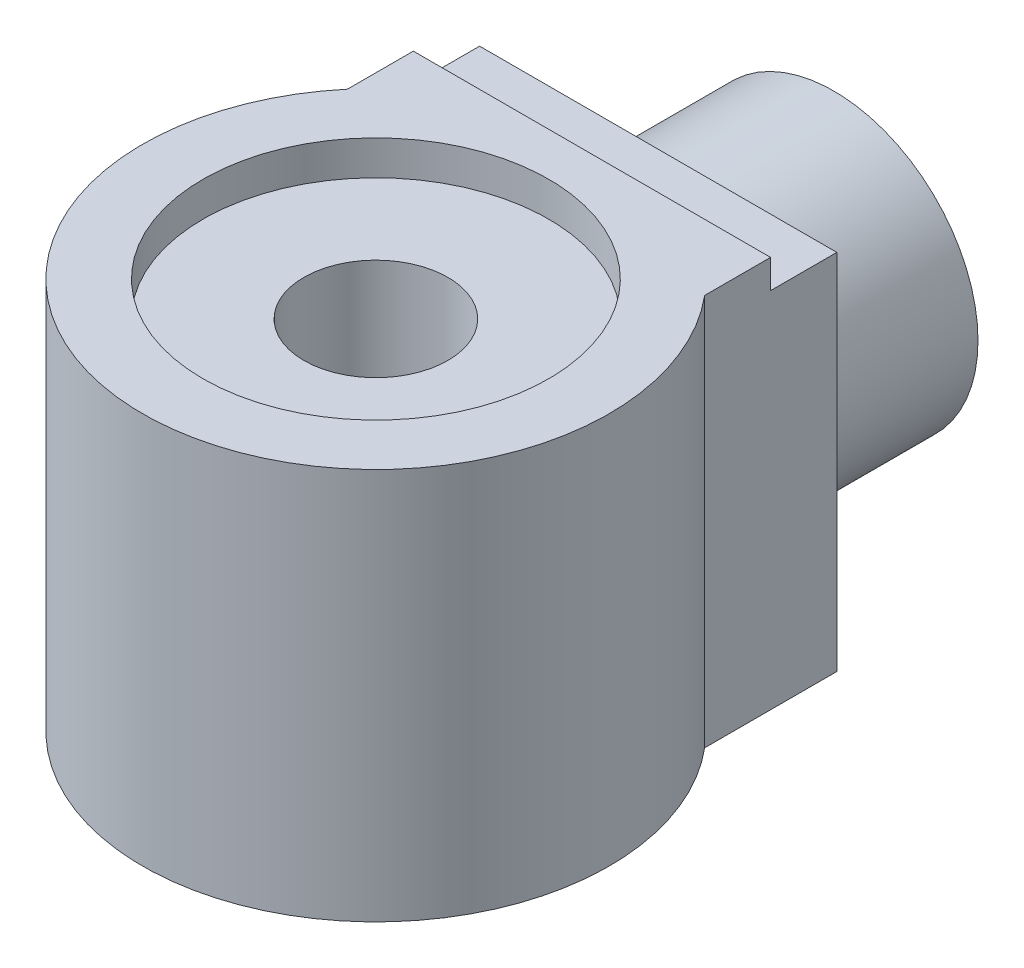
from build123d import *

# Parameters (mm, degrees)
BOSS_EXTRUDE1_DEPTH        = 34.544
SKETCH2_R                  = 15.24
CUT_EXTRUDE1_DEPTH         = 3.048
F_1_2_0_5_DIAMETER_HOLE1_D = 12.7
SKETCH5_W                  = 31.496
SKETCH5_H                  = 5.842
CUT_EXTRUDE2_DEPTH         = 2.54
SKETCH8_R                  = 12.7
SKETCH8_R_2                = 10.668
BOSS_EXTRUDE3_DEPTH        = 15.494
SKETCH9_R                  = 6.477
BOSS_EXTRUDE4_DEPTH        = 19.05
SKETCH6_R                  = 12.7
BOSS_EXTRUDE2_DEPTH        = 15.494
CUT_EXTRUDE3_START         = -15.494
SKETCH7_R                  = 10.668
SKETCH7_R_2                = 6.477
CUT_EXTRUDE3_DEPTH         = 15.494


with BuildPart() as part:
    # Sketch1 → Boss-Extrude1 (new body)
    with BuildSketch(Plane(origin=(0, 0, 0), x_dir=(1, 0, 0), z_dir=(0, 1, 0))):
        with BuildLine():
            Line((15.748, 24.892), (-15.748, 24.892))
            Line((-15.748, 24.892), (-15.748, 13.23971193))
            ThreePointArc((-15.748, 13.23971193), (0, -20.574), (15.748, 13.23971193))
            Line((15.748, 13.23971193), (15.748, 24.892))
        make_face()
    extrude(amount=BOSS_EXTRUDE1_DEPTH)

    # Sketch2 → Cut-Extrude1 (cut)
    with BuildSketch(Plane(origin=(0, 34.544, 0), x_dir=(1, 0, 0), z_dir=(0, 1, 0))):
        with Locations(Location((0, 0, 0), (0, 0, 270))):
            Circle(SKETCH2_R)
    extrude(amount=-CUT_EXTRUDE1_DEPTH, mode=Mode.SUBTRACT)

    # 1/2 (0.5) Diameter Hole1 (through all)
    with Locations(Plane(origin=(0, 31.496, 0), x_dir=(1, 0, 0), z_dir=(0, 1, 0))):
        with Locations((0, 0)):
            Hole(F_1_2_0_5_DIAMETER_HOLE1_D / 2)

    # Sketch5 → Cut-Extrude2 (cut)
    with BuildSketch(Plane(origin=(0, 34.544, 0), x_dir=(1, 0, 0), z_dir=(0, 1, 0))):
        with Locations((0, 21.971)):
            Rectangle(SKETCH5_W, SKETCH5_H)
    extrude(amount=-CUT_EXTRUDE2_DEPTH, mode=Mode.SUBTRACT)

    # Sketch8 → Boss-Extrude3 (add)
    with BuildSketch(Plane(origin=(0, 0, -24.892), x_dir=(-1, 0, 0), z_dir=(0, 0, -1))):
        with Locations(Location((0, 16.002, 0), (0, 0, 180))):
            Circle(SKETCH8_R)
        with Locations((0, 16.002)):
            Circle(SKETCH8_R_2, mode=Mode.SUBTRACT)
    extrude(amount=BOSS_EXTRUDE3_DEPTH)

    # Sketch9 → Boss-Extrude4 (add)
    with BuildSketch(Plane(origin=(0, 0, -24.892), x_dir=(-1, 0, 0), z_dir=(0, 0, -1))):
        with Locations(Location((0, 16.002, 0), (0, 0, 180))):
            Circle(SKETCH9_R)
    extrude(amount=BOSS_EXTRUDE4_DEPTH)

    # Sketch6 → Boss-Extrude2 (add)
    with BuildSketch(Plane(origin=(0, 0, -24.892), x_dir=(-1, 0, 0), z_dir=(0, 0, -1))):
        with Locations(Location((0, 16.002, 0), (0, 0, 180))):
            Circle(SKETCH6_R)
    extrude(amount=BOSS_EXTRUDE2_DEPTH)

    # Sketch7 → Cut-Extrude3 (cut)
    with BuildSketch(Plane(origin=(0, 0, -40.386), x_dir=(-1, 0, 0), z_dir=(0, 0, -1)).offset(CUT_EXTRUDE3_START)):
        with Locations((0, 16.002)):
            Circle(SKETCH7_R)
        with Locations(Location((0, 16.002, 0), (0, 0, 180))):
            Circle(SKETCH7_R_2, mode=Mode.SUBTRACT)
    extrude(amount=CUT_EXTRUDE3_DEPTH, mode=Mode.SUBTRACT)


solid = part.part
